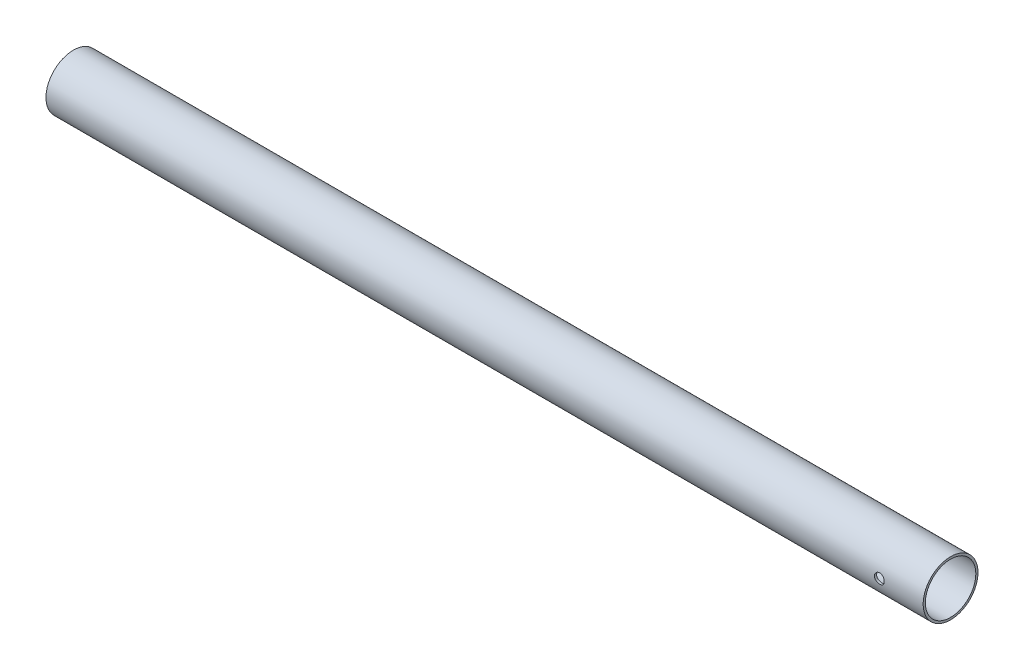
from build123d import *

# Parameters (mm, degrees)
SKETCH2_R            = 12.5
SKETCH2_R_2          = 11.5
BOSS_EXTRUDE1_DEPTH  = 400
M4_CLEARANCE_HOLE1_D = 4.5


with BuildPart() as part:
    # Sketch2 → Boss-Extrude1 (new body)
    with BuildSketch(Plane(origin=(0, 0, 0), x_dir=(0, 0, -1), z_dir=(1, 0, 0))):
        Circle(SKETCH2_R)
        Circle(SKETCH2_R_2, mode=Mode.SUBTRACT)
    extrude(amount=BOSS_EXTRUDE1_DEPTH)

    # M4 Clearance Hole1 (through all)
    with Locations(Plane(origin=(0, 0, -12.5), x_dir=(1, 0, 0), z_dir=(0, 0, -1))):
        with Locations((380, 0)):
            Hole(M4_CLEARANCE_HOLE1_D / 2)


solid = part.part
